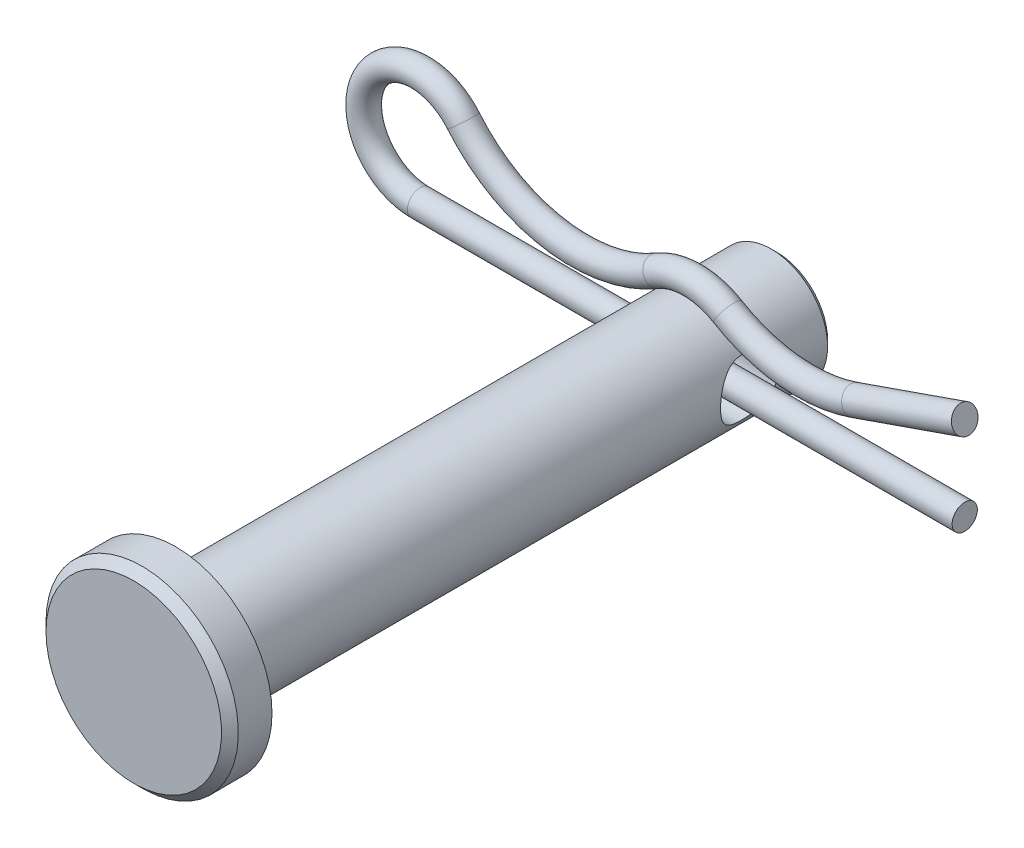
from build123d import *

# Parameters (mm, degrees)
SKETCH1_R           = 2.38125
EXTRUDE1_DEPTH      = 12.7
SKETCH2_R           = 4.064
EXTRUDE2_DEPTH      = 1.778
CHAMFER1_SIZE       = 0.3556
EXTRUDE3_DEPTH      = 16.577056076
EXTRUDE3_DEPTH_BACK = 16.577056076
SKETCH3_R           = 1.190625
CHAMFER2_SIZE       = 0.238125
SKETCH7_R           = 0.5334


with BuildPart() as part:
    # Sketch1 → Extrude1 (new, symmetric)
    with BuildSketch(Plane.XY):
        Circle(SKETCH1_R)
    extrude(amount=EXTRUDE1_DEPTH, both=True)

    # Sketch2 → Extrude2 (add)
    with BuildSketch(Plane.XY.offset(12.7)):
        Circle(SKETCH2_R)
    extrude(amount=EXTRUDE2_DEPTH)

    # Chamfer1
    chamfer1_edges = [part.edges().sort_by_distance(p)[0] for p in [
        (-4.064, 0, 14.478),
    ]]
    chamfer(chamfer1_edges, length=CHAMFER1_SIZE)

    # Sketch3 → Extrude3 (cut, two sides: drawn at the far end of the back side and taken through both)
    with BuildSketch(Plane(origin=(0, 0, 0), x_dir=(0, 0, -1), z_dir=(1, 0, 0)).offset(-EXTRUDE3_DEPTH_BACK)):
        with Locations(Location((9.128125, 0, 0), (0, 0, 179.999999999))):
            Circle(SKETCH3_R)
    extrude(amount=EXTRUDE3_DEPTH + EXTRUDE3_DEPTH_BACK, mode=Mode.SUBTRACT)

    # Chamfer2
    chamfer2_edges = [part.edges().sort_by_distance(p)[0] for p in [
        (-2.38125, 0, -12.7),
    ]]
    chamfer(chamfer2_edges, length=CHAMFER2_SIZE)


with BuildPart() as body_2:
    # Sweep1: sweep along a path in Sketch6
    with BuildLine(Plane.XY.offset(-9.128125)) as sweep1_path:
        Line((11.509375, 0), (-11.509375, 0))
        ThreePointArc((-11.509375, 0), (-13.665265976, 3.392430331), (-9.678408448, 3.903719392))
        ThreePointArc((-9.678408448, 3.903719392), (-5.844791833, 1.691759471), (-1.493743003, 2.502781745))
        ThreePointArc((-1.493743003, 2.502781745), (0, 2.91465), (1.493743003, 2.502781745))
        ThreePointArc((1.493743003, 2.502781745), (4.120038067, 1.633068096), (6.867741763, 1.955483963))
        Line((6.867741763, 1.955483963), (11.509375, 3.571875))
    # Sketch7 → Sweep1 (sweep)
    with BuildSketch(Plane(origin=(11.509375, 0, -9.128125), x_dir=(0, 0, 1), z_dir=(-1, 0, 0))):
        Circle(SKETCH7_R)
    sweep(path=sweep1_path.line)


solid = Compound([part.part, body_2.part])
